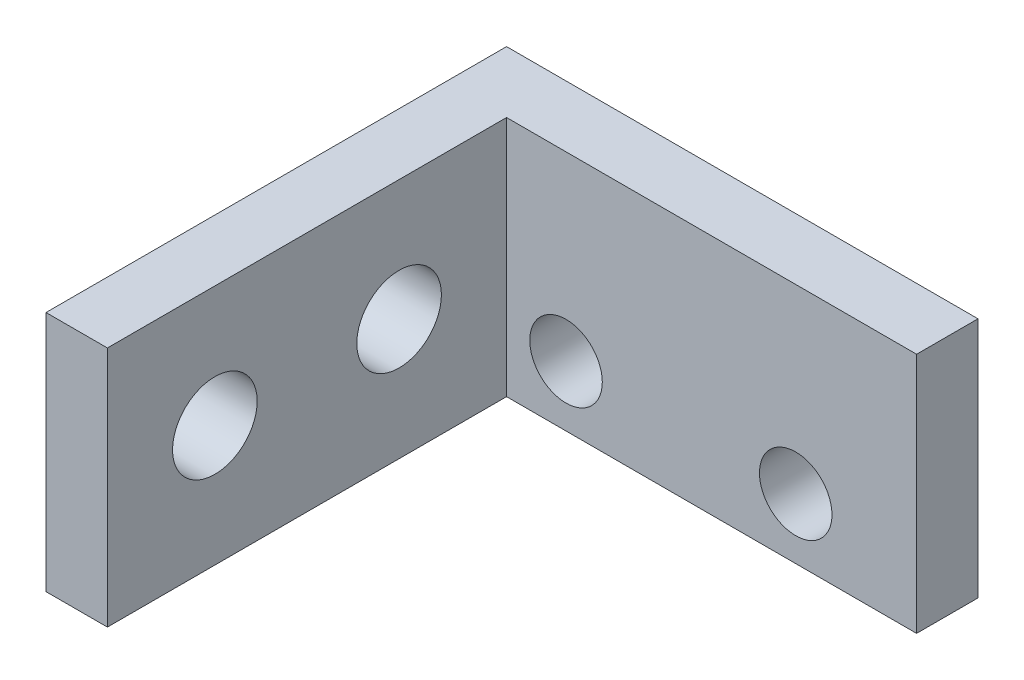
from build123d import *

# Parameters (mm, degrees)
SKETCH2_W           = 19.5
SKETCH2_H           = 10
SKETCH2_R           = 1.5
BOSS_EXTRUDE1_DEPTH = 1.27
SKETCH3_W           = 19.05
SKETCH3_H           = 10
BOSS_EXTRUDE2_DEPTH = 2.54
SKETCH4_R           = 1.75
CUT_EXTRUDE1_DEPTH  = 26.075286638


with BuildPart() as part:
    # Sketch2 → Boss-Extrude1 (new, symmetric)
    with BuildSketch(Plane.XY):
        Rectangle(SKETCH2_W, SKETCH2_H)
        with Locations((-4.75, -2.5)):
            Circle(SKETCH2_R, mode=Mode.SUBTRACT)
        with Locations((4.75, -2.5)):
            Circle(SKETCH2_R, mode=Mode.SUBTRACT)
    extrude(amount=BOSS_EXTRUDE1_DEPTH, both=True)

    # Sketch3 → Boss-Extrude2 (add)
    with BuildSketch(Plane.ZY.offset(9.75)):
        with Locations((8.255, 0)):
            Rectangle(SKETCH3_W, SKETCH3_H)
    extrude(amount=-BOSS_EXTRUDE2_DEPTH)

    # Sketch4 → Cut-Extrude1 (cut, through all)
    with BuildSketch(Plane(origin=(-7.21, 0, 0), x_dir=(0, 0, -1), z_dir=(1, 0, 0))):
        with Locations((-5.715, 0)):
            Circle(SKETCH4_R)
        with Locations((-13.335, 0)):
            Circle(SKETCH4_R)
    extrude(amount=-CUT_EXTRUDE1_DEPTH, mode=Mode.SUBTRACT)


solid = part.part
